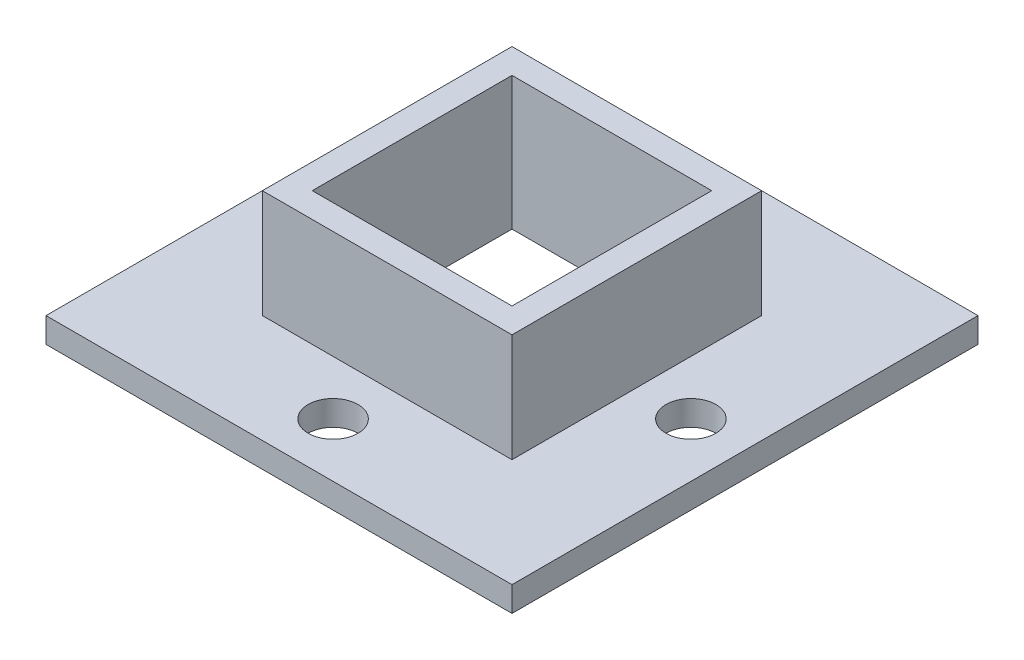
from build123d import *

# Parameters (mm, degrees)
CROQUIS3_W              = 177.8
CROQUIS3_H              = 177.8
CROQUIS3_W_2            = 76.2
CROQUIS3_H_2            = 76.2
SALIENTE_EXTRUIR2_DEPTH = 9.525
CROQUIS4_W              = 95.25
CROQUIS4_H              = 95.25
CROQUIS4_W_2            = 76.2
CROQUIS4_H_2            = 76.2
SALIENTE_EXTRUIR3_DEPTH = 41.275
CROQUIS5_R              = 9.525
CORTAR_EXTRUIR1_DEPTH   = 12


with BuildPart() as part:
    # Croquis3 → Saliente-Extruir2 (new body)
    with BuildSketch(Plane(origin=(0, 0, 0), x_dir=(1, 0, 0), z_dir=(0, 1, 0))):
        Rectangle(CROQUIS3_W, CROQUIS3_H)
        Rectangle(CROQUIS3_W_2, CROQUIS3_H_2, mode=Mode.SUBTRACT)
    extrude(amount=SALIENTE_EXTRUIR2_DEPTH)

    # Croquis4 → Saliente-Extruir3 (add)
    with BuildSketch(Plane(origin=(0, 9.525, 0), x_dir=(1, 0, 0), z_dir=(0, 1, 0))):
        Rectangle(CROQUIS4_W, CROQUIS4_H)
        Rectangle(CROQUIS4_W_2, CROQUIS4_H_2, mode=Mode.SUBTRACT)
    extrude(amount=SALIENTE_EXTRUIR3_DEPTH)

    # Croquis5 → Cortar-Extruir1 (cut)
    with BuildSketch(Plane(origin=(0, 9.525, 0), x_dir=(1, 0, 0), z_dir=(0, 1, 0))):
        with Locations(Location((0, -68.2625, 0), (0, 0, 270))):
            Circle(CROQUIS5_R)
        with Locations(Location((0, 68.2625, 0), (0, 0, 90))):
            Circle(CROQUIS5_R)
        with Locations(Location((-68.2625, 0, 0), (0, 0, 90))):
            Circle(CROQUIS5_R)
        with Locations(Location((68.2625, 0, 0), (0, 0, 270))):
            Circle(CROQUIS5_R)
    extrude(amount=-CORTAR_EXTRUIR1_DEPTH, mode=Mode.SUBTRACT)


solid = part.part
